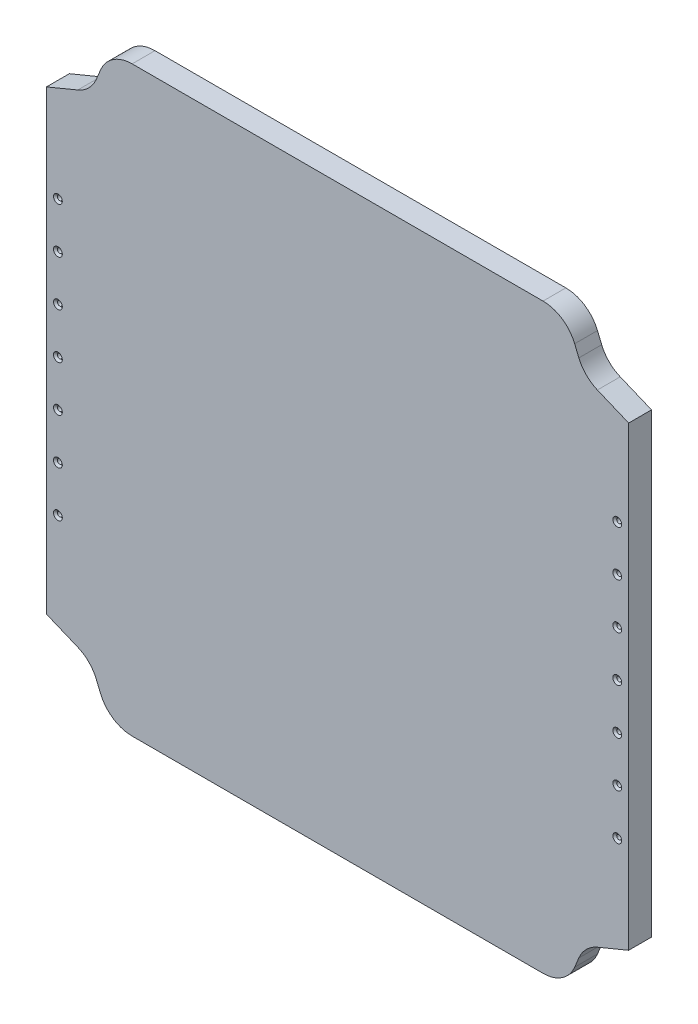
from build123d import *

# Parameters (mm, degrees)
BOSS_EXTRUDE1_DEPTH                                = 25.4
FILLET1_R                                          = 38.1
CSK_FOR_10_FLAT_HEAD_MACHINE_SCREW_100_D           = 5.1054
CSK_FOR_10_FLAT_HEAD_MACHINE_SCREW_100_CSINK_D     = 9.779
CSK_FOR_10_FLAT_HEAD_MACHINE_SCREW_100_CSINK_ANGLE = 100


with BuildPart() as part:
    # Sketch1 → Boss-Extrude1 (new body)
    with BuildSketch(Plane.XY):
        Polygon((-254, 0), (254, 0), (274.458591334, 49.391408666), (323.85, 69.85), (323.85, 577.85), (274.458591334, 598.308591334), (254, 647.7), (-254, 647.7), (-274.458591334, 598.308591334), (-323.85, 577.85), (-323.85, 69.85), (-274.458591334, 49.391408666), align=None)
    extrude(amount=BOSS_EXTRUDE1_DEPTH)

    # Fillet1
    fillet1_edges = [part.edges().sort_by_distance(p)[0] for p in [
        (254, 0, 12.7),
        (-254, 0, 12.7),
        (-274.458591334, 49.391408666, 12.7),
        (-274.458591334, 598.308591334, 12.7),
        (-254, 647.7, 12.7),
        (254, 647.7, 12.7),
        (274.458591334, 598.308591334, 12.7),
        (274.458591334, 49.391408666, 12.7),
    ]]
    fillet(fillet1_edges, radius=FILLET1_R)

    # CSK for #10 Flat Head Machine Screw (100)1 (through all)
    with Locations(Plane.XY.offset(25.4)):
        with Locations((311.15, 323.85), (311.15, 374.65), (311.15, 425.45), (311.15, 273.05), (311.15, 222.25), (311.15, 171.45), (311.15, 476.25)):
            csk_for_10_flat_head_machine_screw_100 = CounterSinkHole(CSK_FOR_10_FLAT_HEAD_MACHINE_SCREW_100_D / 2, CSK_FOR_10_FLAT_HEAD_MACHINE_SCREW_100_CSINK_D / 2, counter_sink_angle=CSK_FOR_10_FLAT_HEAD_MACHINE_SCREW_100_CSINK_ANGLE)

    # Mirror1: CSK for #10 Flat Head Machine Screw (100)1 across plane
    add(csk_for_10_flat_head_machine_screw_100.mirror(Plane(origin=(0, 0, 0), x_dir=(0, 0, 1), z_dir=(1, 0, 0))), mode=Mode.SUBTRACT)


solid = part.part
